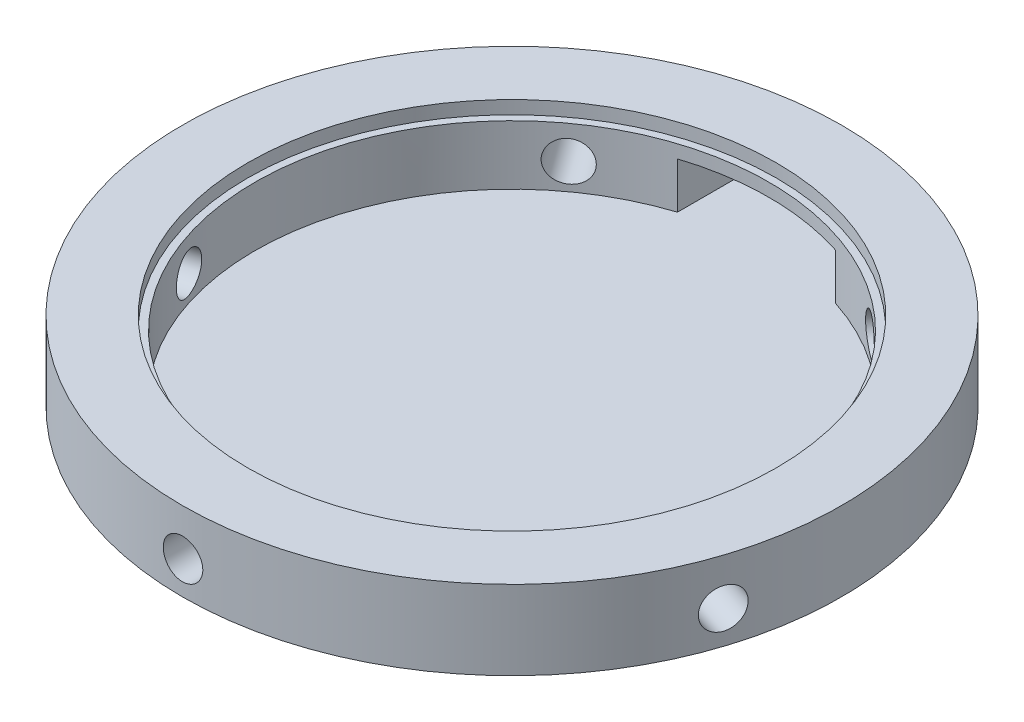
from build123d import *

# Parameters (mm, degrees)
SKETCH1_R           = 50
BOSS_EXTRUDE1_DEPTH = 12
SKETCH3_R           = 40.1
CUT_EXTRUDE1_DEPTH  = 2
SKETCH4_R           = 39
CUT_EXTRUDE2_DEPTH  = 9
SKETCH6_W           = 24
SKETCH6_H           = 7
CUT_EXTRUDE4_DEPTH  = 61
SKETCH7_R           = 3
CUT_EXTRUDE5_DEPTH  = 61
CIRPATTERN1_COUNT   = 5


with BuildPart() as part:
    # Sketch1 → Boss-Extrude1 (new body)
    with BuildSketch(Plane(origin=(0, 0, 0), x_dir=(1, 0, 0), z_dir=(0, 1, 0))):
        with Locations(Location((0, 0, 0), (0, 0, 270))):
            Circle(SKETCH1_R)
    extrude(amount=BOSS_EXTRUDE1_DEPTH)

    # Sketch3 → Cut-Extrude1 (cut)
    with BuildSketch(Plane(origin=(0, 12, 0), x_dir=(1, 0, 0), z_dir=(0, 1, 0))):
        with Locations(Location((0, 0, 0), (0, 0, 270))):
            Circle(SKETCH3_R)
    extrude(amount=-CUT_EXTRUDE1_DEPTH, mode=Mode.SUBTRACT)

    # Sketch4 → Cut-Extrude2 (cut)
    with BuildSketch(Plane(origin=(0, 10, 0), x_dir=(1, 0, 0), z_dir=(0, 1, 0))):
        with Locations(Location((0, 0, 0), (0, 0, 270))):
            Circle(SKETCH4_R)
    extrude(amount=-CUT_EXTRUDE2_DEPTH, mode=Mode.SUBTRACT)

    # Sketch6 → Cut-Extrude4 (cut)
    with BuildSketch(Plane.XY):
        with Locations((0, 4.5)):
            Rectangle(SKETCH6_W, SKETCH6_H)
    extrude(amount=-CUT_EXTRUDE4_DEPTH, mode=Mode.SUBTRACT)

    # Sketch7 → Cut-Extrude5 (cut)
    with BuildSketch(Plane.YX):
        with Locations((5, 0)):
            Circle(SKETCH7_R)
    cut_extrude5 = extrude(amount=-CUT_EXTRUDE5_DEPTH, mode=Mode.SUBTRACT)

    # CirPattern1: Cut-Extrude5 ×5 about axis
    cirpattern1_axis = Axis((0, -0.6, 0), (0, 1, 0))
    for i in range(1, CIRPATTERN1_COUNT):
        add(cut_extrude5.rotate(cirpattern1_axis, i * 360 / CIRPATTERN1_COUNT), mode=Mode.SUBTRACT)


solid = part.part
